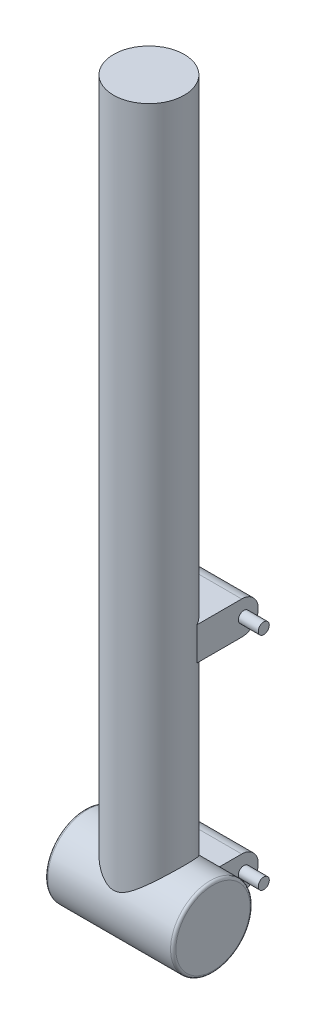
from build123d import *

# Parameters (mm, degrees)
ESQUISSE2_R                          = 180
BOSS_EXTRU_1_DEPTH                   = 290
CONG_1_R                             = 12
ESQUISSE3_R                          = 160
BOSS_EXTRU_2_DEPTH                   = 3200
BOSS_EXTRU_3_DEPTH                   = 140
ESQUISSE5_R                          = 25
BOSS_EXTRU_4_DEPTH                   = 90
R_P_TITION_LIN_AIRE2_COUNT           = 2
R_P_TITION_LIN_AIRE2_PITCH           = 1000
R_P_TITION_LIN_AIRE2_COPY_1_SKETCH_R = 25
R_P_TITION_LIN_AIRE2_COPY_1_DEPTH    = 90


with BuildPart() as part:
    # Esquisse2 → Boss.-Extru.1 (new, symmetric)
    with BuildSketch(Plane(origin=(0, 0, 0), x_dir=(0, 0, -1), z_dir=(1, 0, 0))):
        Circle(ESQUISSE2_R)
    extrude(amount=BOSS_EXTRU_1_DEPTH, both=True)

    # Congé1
    cong_1_edges = [part.edges().sort_by_distance(p)[0] for p in [
        (-290, 0, 180),
        (290, 0, 180),
    ]]
    fillet(cong_1_edges, radius=CONG_1_R)

    # Esquisse3 → Boss.-Extru.2 (add)
    with BuildSketch(Plane(origin=(0, 0, 0), x_dir=(1, 0, 0), z_dir=(0, 1, 0))):
        with Locations(Location((0, 0, 0), (0, 0, 90))):
            Circle(ESQUISSE3_R)
    extrude(amount=BOSS_EXTRU_2_DEPTH)

    # Esquisse4 → Boss.-Extru.3 (add, symmetric)
    with BuildSketch(Plane(origin=(0, 0, 0), x_dir=(0, 0, -1), z_dir=(1, 0, 0))):
        with BuildLine():
            Line((0, 75), (280, 75))
            ThreePointArc((280, 75), (355, 0), (280, -75))
            Line((280, -75), (0, -75))
            ThreePointArc((0, -75), (-75, 0), (0, 75))
        make_face()
    boss_extru_3 = extrude(amount=BOSS_EXTRU_3_DEPTH, both=True)

    # Esquisse5 → Boss.-Extru.4 (add)
    with BuildSketch(Plane(origin=(140, 0, 0), x_dir=(0, 0, -1), z_dir=(1, 0, 0))):
        with Locations(Location((289.958895705, 0, 0), (0, 0, 180))):
            Circle(ESQUISSE5_R)
    boss_extru_4 = extrude(amount=BOSS_EXTRU_4_DEPTH)

    # Symétrie1: Boss.-Extru.4 across plane
    add(boss_extru_4.mirror(Plane(origin=(0, 0, 0), x_dir=(0, 0, 1), z_dir=(1, 0, 0))))

    # Répétition linéaire2: Boss.-Extru.3, Boss.-Extru.4 ×2
    with Locations(*[(0, i * R_P_TITION_LIN_AIRE2_PITCH, 0) for i in range(1, R_P_TITION_LIN_AIRE2_COUNT)]):
        add(boss_extru_3)
        add(boss_extru_4)

    # Répétition linéaire2 copy 1 sketch → Répétition linéaire2 copy 1 (add)
    with BuildSketch(Plane(origin=(-140, 1000, 0), x_dir=(0, 0, -1), z_dir=(-1, 0, 0))):
        with Locations((289.958895705, 0)):
            Circle(R_P_TITION_LIN_AIRE2_COPY_1_SKETCH_R)
    extrude(amount=R_P_TITION_LIN_AIRE2_COPY_1_DEPTH)


solid = part.part
